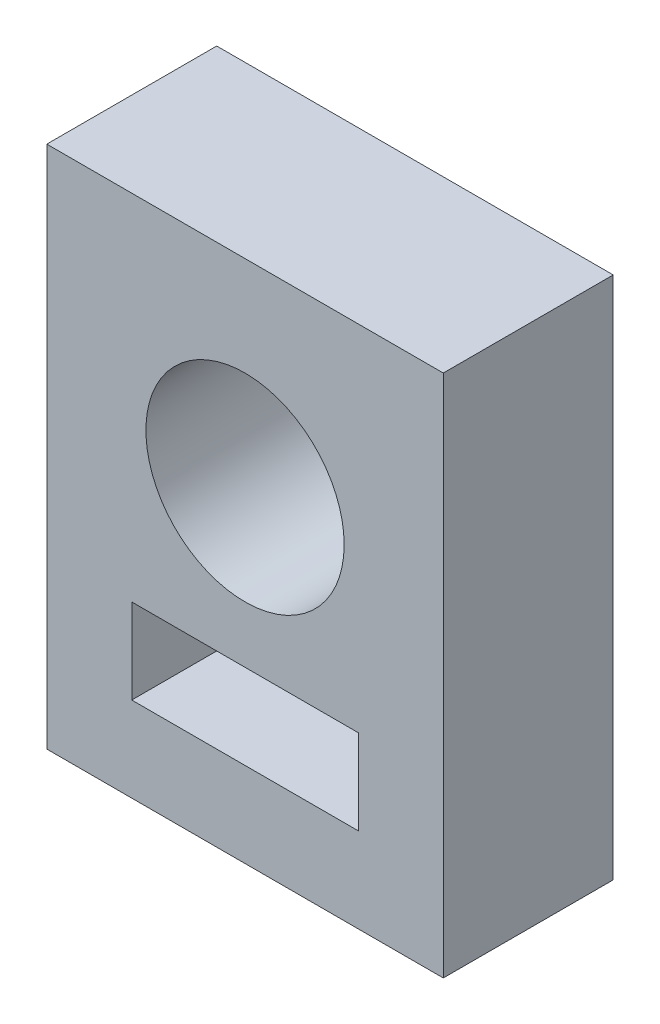
from build123d import *

# Parameters (mm, degrees)
SKETCH1_W           = 14
SKETCH1_H           = 18.5
SKETCH1_R           = 3.5
SKETCH1_W_2         = 8
SKETCH1_H_2         = 3
BOSS_EXTRUDE1_DEPTH = 6


with BuildPart() as part:
    # Sketch1 → Boss-Extrude1 (new body)
    with BuildSketch(Plane.XY):
        Rectangle(SKETCH1_W, SKETCH1_H)
        with Locations((0, 2.25)):
            Circle(SKETCH1_R, mode=Mode.SUBTRACT)
        with Locations((0, -4.75)):
            Rectangle(SKETCH1_W_2, SKETCH1_H_2, mode=Mode.SUBTRACT)
    extrude(amount=BOSS_EXTRUDE1_DEPTH)


solid = part.part
